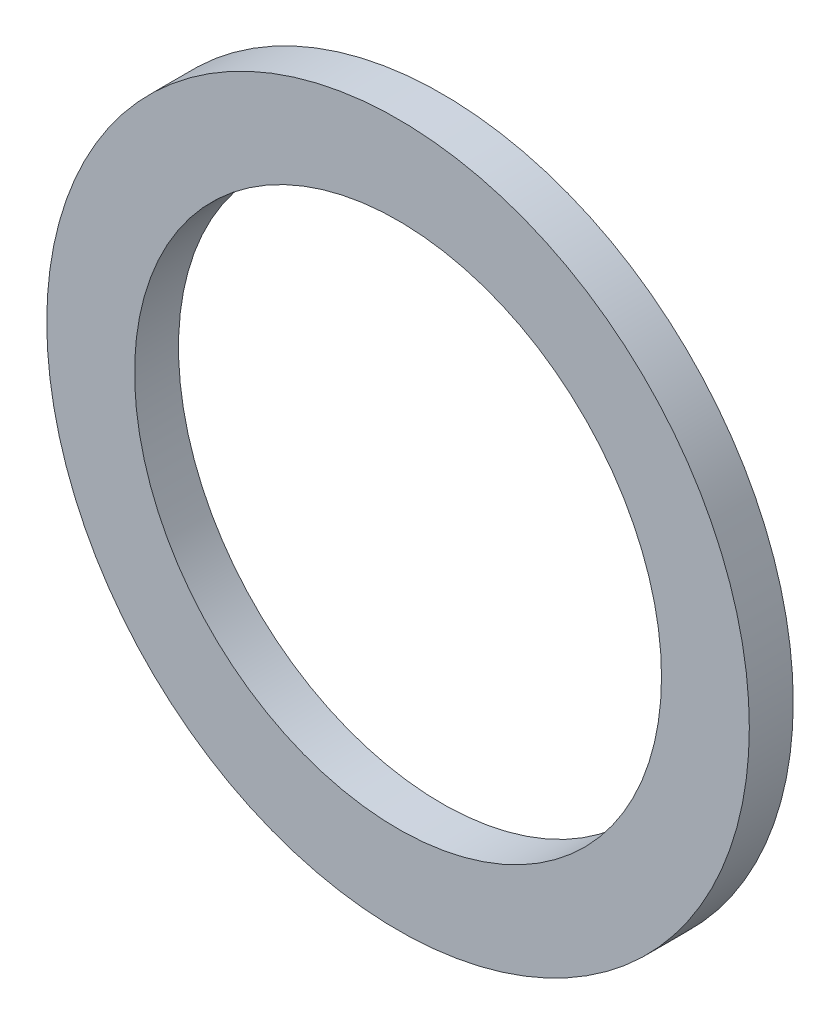
from build123d import *

# Parameters (mm, degrees)
SKETCH1_R           = 20
SKETCH1_R_2         = 15
BOSS_EXTRUDE1_DEPTH = 2.5


with BuildPart() as part:
    # Sketch1 → Boss-Extrude1 (new body)
    with BuildSketch(Plane.XY):
        Circle(SKETCH1_R)
        Circle(SKETCH1_R_2, mode=Mode.SUBTRACT)
    extrude(amount=BOSS_EXTRUDE1_DEPTH)


solid = part.part
